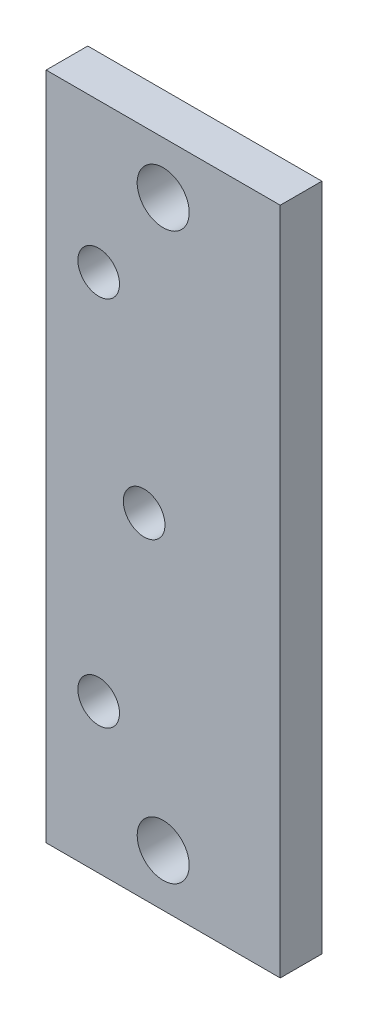
from build123d import *

# Parameters (mm, degrees)
ESQUISSE2_R             = 5
BOSS_EXTRU_2_DEPTH      = 8
ESQUISSE3_W             = 10
ESQUISSE3_H             = 34.323
BOSS_EXTRU_3_DEPTH      = 6
ENL_V_MAT_EXTRU_1_REACH = 139.007
ESQUISSE4_R             = 4


with BuildPart() as part:
    # Esquisse2 → Boss.-Extru.2 (new body)
    with BuildSketch(Plane(origin=(0, 0, 0), x_dir=(-1, 0, 0), z_dir=(0, 0, 1))):
        Polygon((-45, 128.646), (-45, 0), (-5, 0), (0, 0), (0, 64.323), (0, 128.646), (-5.55, 128.646), align=None)
        with Locations(Location((-22.5, 10, 0), (0, 0, 180))):
            Circle(ESQUISSE2_R, mode=Mode.SUBTRACT)
        with Locations((-22.5, 118.646)):
            Circle(ESQUISSE2_R, mode=Mode.SUBTRACT)
    extrude(amount=BOSS_EXTRU_2_DEPTH)

    # Esquisse3 → Boss.-Extru.3 (add)
    with BuildSketch(Plane(origin=(0, 0, 0), x_dir=(-1, 0, 0), z_dir=(0, 0, -1))):
        with Locations((-22.5, -91.4845)):
            Rectangle(ESQUISSE3_W, ESQUISSE3_H)
        with Locations((-22.5, -37.1615)):
            Rectangle(ESQUISSE3_W, ESQUISSE3_H)
    extrude(amount=BOSS_EXTRU_3_DEPTH)

    # Esquisse4 → Enlèv. mat.-Extru.1 (cut, up to next)
    with BuildSketch(Plane.XY.offset(8), mode=Mode.PRIVATE) as enl_v_mat_extru_1_sk1:
        with Locations((10.1018, -28.6106)):
            Circle(ESQUISSE4_R)
    enl_v_mat_extru_1_tool1 = extrude(enl_v_mat_extru_1_sk1.sketch, amount=-ENL_V_MAT_EXTRU_1_REACH, mode=Mode.PRIVATE) & part.part
    # Esquisse4 → Enlèv. mat.-Extru.1 (cut, up to next)
    with BuildSketch(Plane.XY.offset(8), mode=Mode.PRIVATE) as enl_v_mat_extru_1_sk2:
        with Locations((10.1018, -100.0354)):
            Circle(ESQUISSE4_R)
    enl_v_mat_extru_1_tool2 = extrude(enl_v_mat_extru_1_sk2.sketch, amount=-ENL_V_MAT_EXTRU_1_REACH, mode=Mode.PRIVATE) & part.part
    # Esquisse4 → Enlèv. mat.-Extru.1 (cut, up to next)
    with BuildSketch(Plane.XY.offset(8), mode=Mode.PRIVATE) as enl_v_mat_extru_1_sk3:
        with Locations((18.84, -64.323)):
            Circle(ESQUISSE4_R)
    enl_v_mat_extru_1_tool3 = extrude(enl_v_mat_extru_1_sk3.sketch, amount=-ENL_V_MAT_EXTRU_1_REACH, mode=Mode.PRIVATE) & part.part
    add(enl_v_mat_extru_1_tool1.solids().sort_by_distance((10.1018, -28.6106, 8))[0], mode=Mode.SUBTRACT)
    add(enl_v_mat_extru_1_tool2.solids().sort_by_distance((10.1018, -100.0354, 8))[0], mode=Mode.SUBTRACT)
    add(enl_v_mat_extru_1_tool3.solids().sort_by_distance((18.84, -64.323, 8))[0], mode=Mode.SUBTRACT)


solid = part.part
